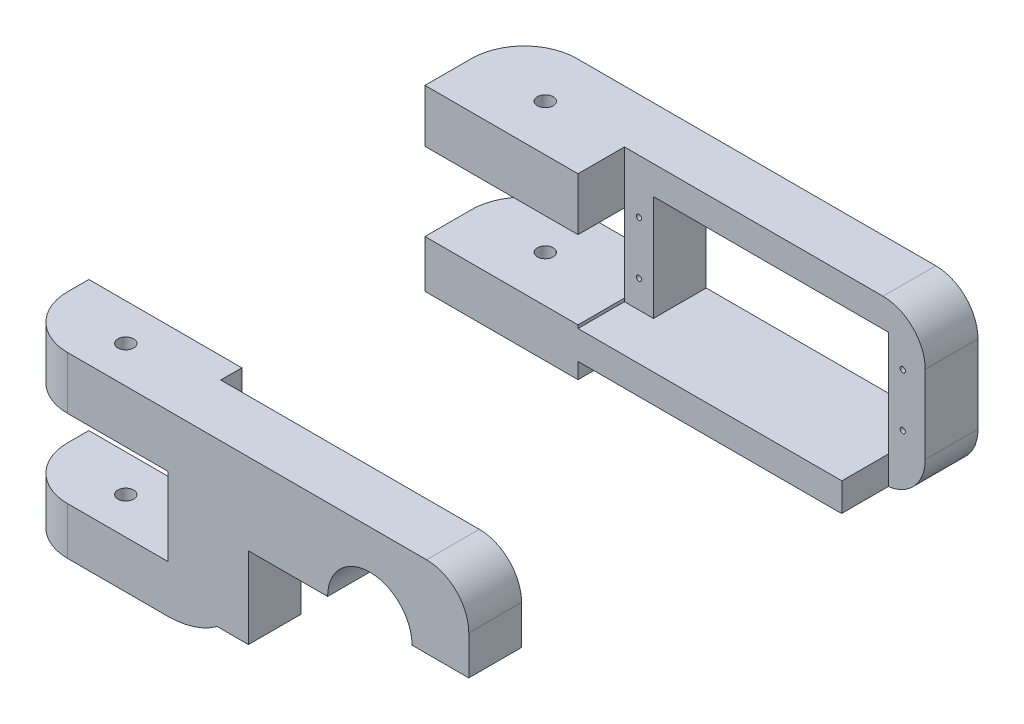
from build123d import *

# Parameters (mm, degrees)
SKETCH1_R           = 8
BOSS_EXTRUDE1_DEPTH = 96.5
SKETCH2_W           = 57
SKETCH2_H           = 76.5
CUT_EXTRUDE1_DEPTH  = 102
FILLET1_R           = 8
SKETCH3_R           = 1.5
CUT_EXTRUDE2_DEPTH  = 134.606474394
CUT_EXTRUDE3_REACH  = 128.573
SKETCH4_R           = 0.5
SKETCH4_W           = 44.5
SKETCH4_H           = 20
BOSS_EXTRUDE2_START = 8.8
BOSS_EXTRUDE2_DEPTH = 8.8
CUT_EXTRUDE4_DEPTH  = 10
FILLET3_R           = 10
SKETCH7_W           = 29
SKETCH7_H           = 63.7
CUT_EXTRUDE5_DEPTH  = 134.606474394


with BuildPart() as part:
    # Sketch1 → Boss-Extrude1 (new body)
    with BuildSketch(Plane.XY):
        with BuildLine():
            Line((86, 0), (0, 0))
            Line((0, 0), (0, -10))
            Line((0, -10), (29, -10))
            Line((29, -10), (29, -24.8))
            Line((29, -24.8), (0, -24.8))
            Line((0, -24.8), (0, -33.8))
            Line((0, -33.8), (29, -33.8))
            ThreePointArc((29, -33.8), (33.898979486, -33.031546212), (38.327379053, -30.8))
            Line((38.327379053, -30.8), (86, -30.8))
            Line((86, -30.8), (86, 0))
        make_face()
        with Locations((67.25, -15.4)):
            Circle(SKETCH1_R, mode=Mode.SUBTRACT)
    extrude(amount=BOSS_EXTRUDE1_DEPTH)

    # Sketch2 → Cut-Extrude1 (cut)
    with BuildSketch(Plane(origin=(0, 0, 0), x_dir=(1, 0, 0), z_dir=(0, 1, 0))):
        with Locations((57.5, -48.25)):
            Rectangle(SKETCH2_W, SKETCH2_H)
    extrude(amount=-CUT_EXTRUDE1_DEPTH, mode=Mode.SUBTRACT)

    # Fillet1
    fillet1_edges = [part.edges().sort_by_distance(p)[0] for p in [
        (86, -30.8, 91.5),
        (86, 0, 91.5),
        (86, -30.8, 5),
        (86, 0, 5),
    ]]
    fillet(fillet1_edges, radius=FILLET1_R)

    # Sketch3 → Cut-Extrude2 (cut, through all)
    with BuildSketch(Plane(origin=(0, 0, 0), x_dir=(1, 0, 0), z_dir=(0, 1, 0))):
        with Locations(Location((14, -10, 0), (0, 0, 270))):
            Circle(SKETCH3_R)
        with Locations(Location((14, -89.5, 0), (0, 0, 270))):
            Circle(SKETCH3_R)
    extrude(amount=-CUT_EXTRUDE2_DEPTH, mode=Mode.SUBTRACT)

    # Sketch4 → Cut-Extrude3 (cut, up to next)
    with BuildSketch(Plane.XY.offset(10), mode=Mode.PRIVATE) as cut_extrude3_sk1:
        with Locations((81.75, -20.171836185)):
            Circle(SKETCH4_R)
    cut_extrude3_tool1 = extrude(cut_extrude3_sk1.sketch, amount=-CUT_EXTRUDE3_REACH, mode=Mode.PRIVATE) & part.part
    # Sketch4 → Cut-Extrude3 (cut, up to next)
    with BuildSketch(Plane.XY.offset(10), mode=Mode.PRIVATE) as cut_extrude3_sk2:
        with Locations((81.75, -10.171836185)):
            Circle(SKETCH4_R)
    cut_extrude3_tool2 = extrude(cut_extrude3_sk2.sketch, amount=-CUT_EXTRUDE3_REACH, mode=Mode.PRIVATE) & part.part
    # Sketch4 → Cut-Extrude3 (cut, up to next)
    with BuildSketch(Plane.XY.offset(10), mode=Mode.PRIVATE) as cut_extrude3_sk3:
        with Locations((31.75, -20.171836185)):
            Circle(SKETCH4_R)
    cut_extrude3_tool3 = extrude(cut_extrude3_sk3.sketch, amount=-CUT_EXTRUDE3_REACH, mode=Mode.PRIVATE) & part.part
    # Sketch4 → Cut-Extrude3 (cut, up to next)
    with BuildSketch(Plane.XY.offset(10), mode=Mode.PRIVATE) as cut_extrude3_sk4:
        with Locations((31.75, -10.171836185)):
            Circle(SKETCH4_R)
    cut_extrude3_tool4 = extrude(cut_extrude3_sk4.sketch, amount=-CUT_EXTRUDE3_REACH, mode=Mode.PRIVATE) & part.part
    # Sketch4 → Cut-Extrude3 (cut, up to next)
    with BuildSketch(Plane.XY.offset(10), mode=Mode.PRIVATE) as cut_extrude3_sk5:
        with Locations((56.75, -15.4)):
            Rectangle(SKETCH4_W, SKETCH4_H)
    cut_extrude3_tool5 = extrude(cut_extrude3_sk5.sketch, amount=-CUT_EXTRUDE3_REACH, mode=Mode.PRIVATE) & part.part
    add(cut_extrude3_tool1.solids().sort_by_distance((81.75, -20.171836, 10))[0], mode=Mode.SUBTRACT)
    add(cut_extrude3_tool2.solids().sort_by_distance((81.75, -10.171836, 10))[0], mode=Mode.SUBTRACT)
    add(cut_extrude3_tool3.solids().sort_by_distance((31.75, -20.171836, 10))[0], mode=Mode.SUBTRACT)
    add(cut_extrude3_tool4.solids().sort_by_distance((31.75, -10.171836, 10))[0], mode=Mode.SUBTRACT)
    add(cut_extrude3_tool5.solids().sort_by_distance((56.75, -15.4, 10))[0], mode=Mode.SUBTRACT)

    # Sketch5 → Boss-Extrude2 (add)
    with BuildSketch(Plane.XY.offset(10).offset(BOSS_EXTRUDE2_START)):
        with BuildLine():
            Line((79, -30.737253933), (79, -25.4))
            Line((79, -25.4), (34.5, -25.4))
            Line((34.5, -25.4), (29, -25.4))
            Line((29, -25.4), (29, -30.8))
            Line((29, -30.8), (38.327379053, -30.8))
            Line((38.327379053, -30.8), (42.496230888, -30.8))
            Line((42.496230888, -30.8), (78, -30.8))
            ThreePointArc((78, -30.8), (78.5009833, -30.784298074), (79, -30.737253933))
        make_face()
    extrude(amount=-BOSS_EXTRUDE2_DEPTH)

    # Sketch6 → Cut-Extrude4 (cut)
    with BuildSketch(Plane.XY.offset(96.5)):
        with BuildLine():
            Line((75.25, -15.4), (86, -15.4))
            Line((86, -15.4), (86, -22.8))
            ThreePointArc((86, -22.8), (83.656854249, -28.456854249), (78, -30.8))
            Line((78, -30.8), (44.25, -30.8))
            Line((44.25, -30.8), (44.25, -15.4))
            Line((44.25, -15.4), (59.25, -15.4))
            ThreePointArc((59.25, -15.4), (67.25, -23.4), (75.25, -15.4))
        make_face()
    extrude(amount=-CUT_EXTRUDE4_DEPTH, mode=Mode.SUBTRACT)

    # Fillet3
    fillet3_edges = [part.edges().sort_by_distance(p)[0] for p in [
        (0, -29.3, 96.5),
        (0, -5, 96.5),
        (0, -5, 0),
        (0, -29.3, 0),
    ]]
    fillet(fillet3_edges, radius=FILLET3_R)

    # Sketch7 → Cut-Extrude5 (cut, through all)
    with BuildSketch(Plane(origin=(0, 0, 0), x_dir=(1, 0, 0), z_dir=(0, 1, 0))):
        with Locations((14.5, -50.65)):
            Rectangle(SKETCH7_W, SKETCH7_H)
    extrude(amount=-CUT_EXTRUDE5_DEPTH, mode=Mode.SUBTRACT)


with BuildPart() as cut_extrude5_piece_1:
    # of the separate pieces the step leaves, piece 1, a body of its own (cut_extrude5_pieces)
    add(part.part.solids().sort_by_distance((10, 0, 0))[0])


with BuildPart() as cut_extrude5_piece_2:
    # of the separate pieces the step leaves, piece 2, a body of its own (cut_extrude5_pieces)
    add(part.part.solids().sort_by_distance((0, 0, 82.5))[0])


solid = Compound([cut_extrude5_piece_1.part, cut_extrude5_piece_2.part])
